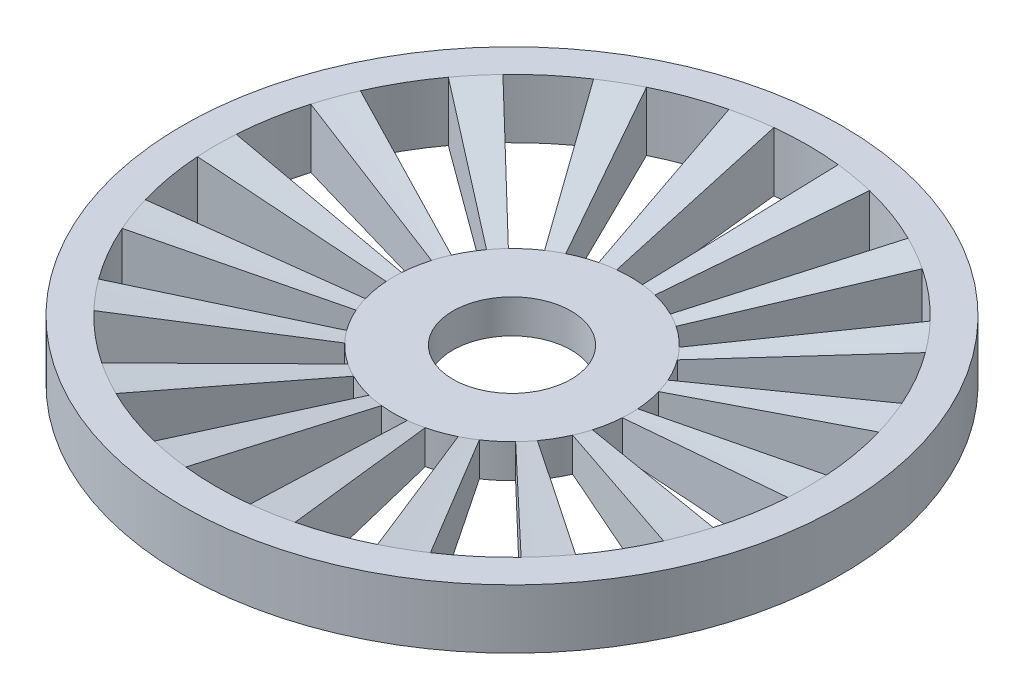
from build123d import *

# Parameters (mm, degrees)
SKETCH1_R           = 19.5
SKETCH1_R_2         = 17.5
BOSS_EXTRUDE1_DEPTH = 3.5
SKETCH2_R           = 7
BOSS_EXTRUDE2_DEPTH = 2
BOSS_EXTRUDE3_DEPTH = 3.5
SKETCH8_R           = 3.5
CUT_EXTRUDE1_DEPTH  = 28.649593125


with BuildPart() as part:
    # Sketch1 → Boss-Extrude1 (new body)
    with BuildSketch(Plane(origin=(0, 0, 0), x_dir=(1, 0, 0), z_dir=(0, 1, 0))):
        with Locations(Location((0, 0, 0), (0, 0, 270))):
            Circle(SKETCH1_R)
        with Locations(Location((0, 0, 0), (0, 0, 270))):
            Circle(SKETCH1_R_2, mode=Mode.SUBTRACT)
    extrude(amount=BOSS_EXTRUDE1_DEPTH)



with BuildPart() as body_2:
    # Sketch2 → Boss-Extrude2 (new body)
    with BuildSketch(Plane(origin=(0, 0, 0), x_dir=(1, 0, 0), z_dir=(0, 1, 0))):
        with Locations(Location((0, 0, 0), (0, 0, 270))):
            Circle(SKETCH2_R)
    extrude(amount=BOSS_EXTRUDE2_DEPTH)


with BuildPart() as part_1:
    add(part.part)

    add(body_2.part)  # Boss-Extrude3 merges body 2
    # Sketch4 → Boss-Extrude3 (add)
    with BuildSketch(Plane(origin=(0, 0, 0), x_dir=(1, 0, 0), z_dir=(0, 1, 0))):
        with BuildLine():
            Line((0.76143589, 6.958463579), (1.903589725, 17.396158948))
            ThreePointArc((1.903589725, 17.396158948), (3.038843109, 17.234135678), (4.161047559, 16.998108224))
            Line((4.161047559, 16.998108224), (1.664419024, 6.79924329))
            ThreePointArc((1.664419024, 6.79924329), (1.215537244, 6.893654271), (0.76143589, 6.958463579))
        make_face()
        with BuildLine():
            Line((3.095450398, 6.278390465), (7.738625995, 15.695976163))
            ThreePointArc((7.738625995, 15.695976163), (8.75, 15.155444566), (9.723801097, 14.549834783))
            Line((9.723801097, 14.549834783), (3.889520439, 5.819933913))
            ThreePointArc((3.889520439, 5.819933913), (3.5, 6.062177826), (3.095450398, 6.278390465))
        make_face()
        with BuildLine():
            Line((5.056107904, 4.841050802), (12.640269759, 12.102627005))
            ThreePointArc((12.640269759, 12.102627005), (13.405777755, 11.24878317), (14.113720715, 10.346636535))
            Line((14.113720715, 10.346636535), (5.645488286, 4.138654614))
            ThreePointArc((5.645488286, 4.138654614), (5.362311102, 4.499513268), (5.056107904, 4.841050802))
        make_face()
        with BuildLine():
            Line((6.406924176, 2.819808966), (16.01731044, 7.049522414))
            ThreePointArc((16.01731044, 7.049522414), (16.444620864, 5.985352508), (16.801317318, 4.89548122))
            Line((16.801317318, 4.89548122), (6.720526927, 1.958192488))
            ThreePointArc((6.720526927, 1.958192488), (6.577848346, 2.394141003), (6.406924176, 2.819808966))
        make_face()
        with BuildLine():
            Line((6.984970837, 0.458456552), (17.462427092, 1.14614138))
            ThreePointArc((17.462427092, 1.14614138), (17.5, 0), (17.462427092, -1.14614138))
            Line((17.462427092, -1.14614138), (6.984970837, -0.458456552))
            ThreePointArc((6.984970837, -0.458456552), (7, 0), (6.984970837, 0.458456552))
        make_face()
        with BuildLine():
            Line((6.720526927, -1.958192488), (16.801317318, -4.89548122))
            ThreePointArc((16.801317318, -4.89548122), (16.444620864, -5.985352508), (16.01731044, -7.049522414))
            Line((16.01731044, -7.049522414), (6.406924176, -2.819808966))
            ThreePointArc((6.406924176, -2.819808966), (6.577848346, -2.394141003), (6.720526927, -1.958192488))
        make_face()
        with BuildLine():
            Line((5.645488286, -4.138654614), (14.113720715, -10.346636535))
            ThreePointArc((14.113720715, -10.346636535), (13.405777755, -11.24878317), (12.640269759, -12.102627005))
            Line((12.640269759, -12.102627005), (5.056107904, -4.841050802))
            ThreePointArc((5.056107904, -4.841050802), (5.362311102, -4.499513268), (5.645488286, -4.138654614))
        make_face()
        with BuildLine():
            Line((3.889520439, -5.819933913), (9.723801097, -14.549834783))
            ThreePointArc((9.723801097, -14.549834783), (8.75, -15.155444566), (7.738625995, -15.695976163))
            Line((7.738625995, -15.695976163), (3.095450398, -6.278390465))
            ThreePointArc((3.095450398, -6.278390465), (3.5, -6.062177826), (3.889520439, -5.819933913))
        make_face()
        with BuildLine():
            Line((1.664419024, -6.79924329), (4.161047559, -16.998108224))
            ThreePointArc((4.161047559, -16.998108224), (3.038843109, -17.234135678), (1.903589725, -17.396158948))
            Line((1.903589725, -17.396158948), (0.76143589, -6.958463579))
            ThreePointArc((0.76143589, -6.958463579), (1.215537244, -6.893654271), (1.664419024, -6.79924329))
        make_face()
        with BuildLine():
            Line((-0.76143589, -6.958463579), (-1.903589725, -17.396158948))
            ThreePointArc((-1.903589725, -17.396158948), (-3.038843109, -17.234135678), (-4.161047559, -16.998108224))
            Line((-4.161047559, -16.998108224), (-1.664419024, -6.79924329))
            ThreePointArc((-1.664419024, -6.79924329), (-1.215537244, -6.893654271), (-0.76143589, -6.958463579))
        make_face()
        with BuildLine():
            Line((-3.095450398, -6.278390465), (-7.738625995, -15.695976163))
            ThreePointArc((-7.738625995, -15.695976163), (-8.75, -15.155444566), (-9.723801097, -14.549834783))
            Line((-9.723801097, -14.549834783), (-3.889520439, -5.819933913))
            ThreePointArc((-3.889520439, -5.819933913), (-3.5, -6.062177826), (-3.095450398, -6.278390465))
        make_face()
        with BuildLine():
            Line((-5.056107904, -4.841050802), (-12.640269759, -12.102627005))
            ThreePointArc((-12.640269759, -12.102627005), (-13.405777755, -11.24878317), (-14.113720715, -10.346636535))
            Line((-14.113720715, -10.346636535), (-5.645488286, -4.138654614))
            ThreePointArc((-5.645488286, -4.138654614), (-5.362311102, -4.499513268), (-5.056107904, -4.841050802))
        make_face()
        with BuildLine():
            Line((-6.406924176, -2.819808966), (-16.01731044, -7.049522414))
            ThreePointArc((-16.01731044, -7.049522414), (-16.444620864, -5.985352508), (-16.801317318, -4.89548122))
            Line((-16.801317318, -4.89548122), (-6.720526927, -1.958192488))
            ThreePointArc((-6.720526927, -1.958192488), (-6.577848346, -2.394141003), (-6.406924176, -2.819808966))
        make_face()
        with BuildLine():
            Line((-6.984970837, -0.458456552), (-17.462427092, -1.14614138))
            ThreePointArc((-17.462427092, -1.14614138), (-17.5, 0), (-17.462427092, 1.14614138))
            Line((-17.462427092, 1.14614138), (-6.984970837, 0.458456552))
            ThreePointArc((-6.984970837, 0.458456552), (-7, 0), (-6.984970837, -0.458456552))
        make_face()
        with BuildLine():
            Line((-6.720526927, 1.958192488), (-16.801317318, 4.89548122))
            ThreePointArc((-16.801317318, 4.89548122), (-16.444620864, 5.985352508), (-16.01731044, 7.049522414))
            Line((-16.01731044, 7.049522414), (-6.406924176, 2.819808966))
            ThreePointArc((-6.406924176, 2.819808966), (-6.577848346, 2.394141003), (-6.720526927, 1.958192488))
        make_face()
        with BuildLine():
            Line((-5.645488286, 4.138654614), (-14.113720715, 10.346636535))
            ThreePointArc((-14.113720715, 10.346636535), (-13.405777755, 11.24878317), (-12.640269759, 12.102627005))
            Line((-12.640269759, 12.102627005), (-5.056107904, 4.841050802))
            ThreePointArc((-5.056107904, 4.841050802), (-5.362311102, 4.499513268), (-5.645488286, 4.138654614))
        make_face()
        with BuildLine():
            Line((-3.889520439, 5.819933913), (-9.723801097, 14.549834783))
            ThreePointArc((-9.723801097, 14.549834783), (-8.75, 15.155444566), (-7.738625995, 15.695976163))
            Line((-7.738625995, 15.695976163), (-3.095450398, 6.278390465))
            ThreePointArc((-3.095450398, 6.278390465), (-3.5, 6.062177826), (-3.889520439, 5.819933913))
        make_face()
        with BuildLine():
            Line((-1.664419024, 6.79924329), (-4.161047559, 16.998108224))
            ThreePointArc((-4.161047559, 16.998108224), (-3.038843109, 17.234135678), (-1.903589725, 17.396158948))
            Line((-1.903589725, 17.396158948), (-0.76143589, 6.958463579))
            ThreePointArc((-0.76143589, 6.958463579), (-1.215537244, 6.893654271), (-1.664419024, 6.79924329))
        make_face()
    extrude(amount=BOSS_EXTRUDE3_DEPTH)

    # Sketch7 → Cut-Revolve1 (revolve, cut)
    with BuildSketch(Plane.XY):
        Polygon((7, 2), (17.5, 3.5), (7, 3.5), align=None)
    revolve(axis=Axis((0, -983.4456259, 0), (0, 1, 0)), mode=Mode.SUBTRACT)

    # Sketch8 → Cut-Extrude1 (cut, through all)
    with BuildSketch(Plane(origin=(0, 2, 0), x_dir=(1, 0, 0), z_dir=(0, 1, 0))):
        with Locations(Location((0, 0, 0), (0, 0, 270))):
            Circle(SKETCH8_R)
    extrude(amount=-CUT_EXTRUDE1_DEPTH, mode=Mode.SUBTRACT)


solid = part_1.part
